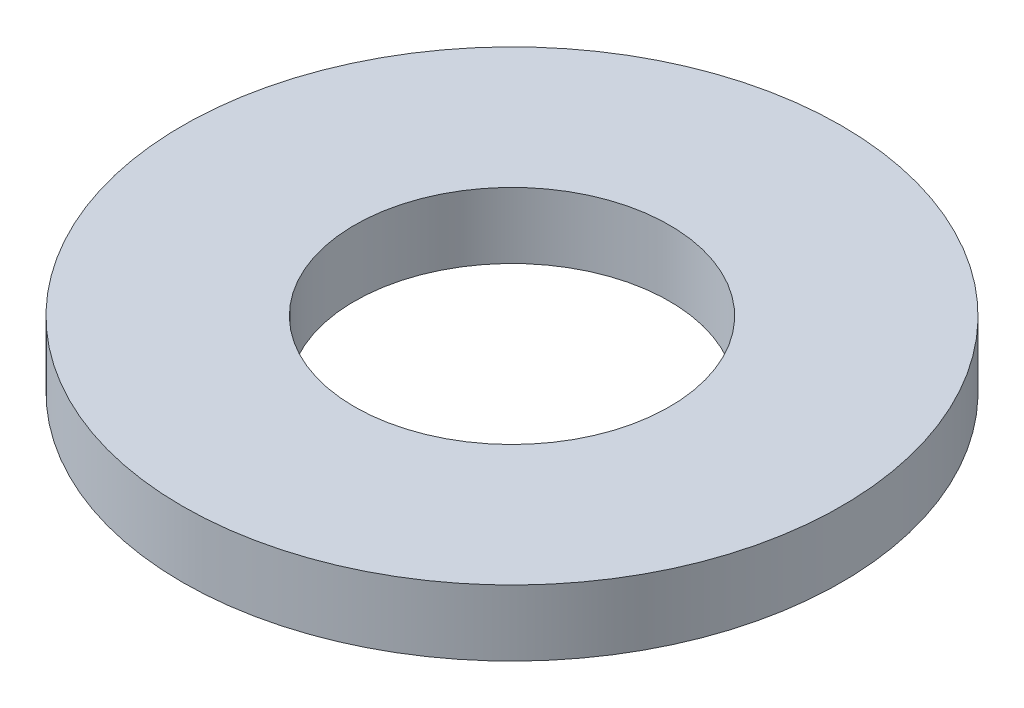
from build123d import *

# Parameters (mm, degrees)
IZIM2_R          = 4.5
IZIM2_R_2        = 2.15
EXTRUDE_M4_DEPTH = 0.9


with BuildPart() as part:
    # Çizim2 → M4 (new body)
    with BuildSketch(Plane(origin=(0, 0, 0), x_dir=(1, 0, 0), z_dir=(0, 1, 0))):
        with Locations(Location((0, 0, 0), (0, 0, 270))):
            Circle(IZIM2_R)
        with Locations(Location((0, 0, 0), (0, 0, 270))):
            Circle(IZIM2_R_2, mode=Mode.SUBTRACT)
    extrude(amount=EXTRUDE_M4_DEPTH)


solid = part.part
